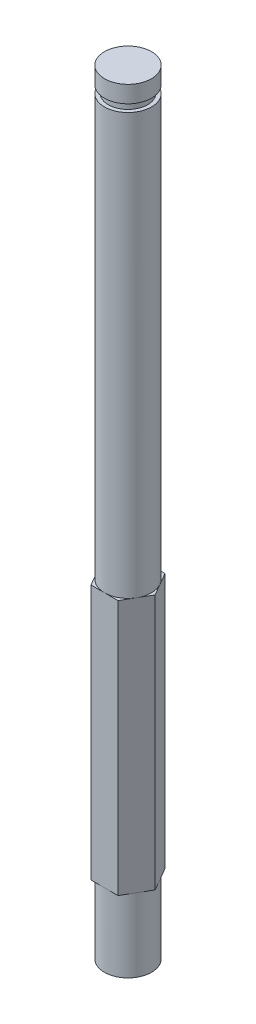
from build123d import *

# Parameters (mm, degrees)
BOSS_EXTRUDE1_DEPTH = 34.544
SKETCH2_R           = 3.175
BOSS_EXTRUDE2_DEPTH = 56.896
SKETCH3_R           = 2.667
BOSS_EXTRUDE3_DEPTH = 1.016
SKETCH4_R           = 3.175
BOSS_EXTRUDE4_DEPTH = 2.286
BOSS_EXTRUDE5_START = 9.906
SKETCH5_R           = 3.175
BOSS_EXTRUDE5_DEPTH = 9.906


with BuildPart() as part:
    # Sketch1 → Boss-Extrude1 (new body)
    with BuildSketch(Plane(origin=(0, 0, 0), x_dir=(1, 0, 0), z_dir=(0, 1, 0))):
        Polygon((1.833087105, 3.175), (-1.833087105, 3.175), (-3.666174209, 0), (-1.833087105, -3.175), (1.833087105, -3.175), (3.666174209, 0), align=None)
    extrude(amount=BOSS_EXTRUDE1_DEPTH)

    # Sketch2 → Boss-Extrude2 (add)
    with BuildSketch(Plane(origin=(0, 34.544, 0), x_dir=(1, 0, 0), z_dir=(0, 1, 0))):
        with Locations(Location((0, 0, 0), (0, 0, 270))):
            Circle(SKETCH2_R)
    extrude(amount=BOSS_EXTRUDE2_DEPTH)

    # Sketch3 → Boss-Extrude3 (add)
    with BuildSketch(Plane(origin=(0, 91.44, 0), x_dir=(1, 0, 0), z_dir=(0, 1, 0))):
        with Locations(Location((0, 0, 0), (0, 0, 270))):
            Circle(SKETCH3_R)
    extrude(amount=BOSS_EXTRUDE3_DEPTH)

    # Sketch4 → Boss-Extrude4 (add)
    with BuildSketch(Plane(origin=(0, 92.456, 0), x_dir=(1, 0, 0), z_dir=(0, 1, 0))):
        with Locations(Location((0, 0, 0), (0, 0, 270))):
            Circle(SKETCH4_R)
    extrude(amount=BOSS_EXTRUDE4_DEPTH)

    # Sketch5 → Boss-Extrude5 (add)
    with BuildSketch(Plane.XZ.offset(BOSS_EXTRUDE5_START)):
        with Locations(Location((0, 0, 0), (0, 0, 90))):
            Circle(SKETCH5_R)
    extrude(amount=-BOSS_EXTRUDE5_DEPTH)


solid = part.part
